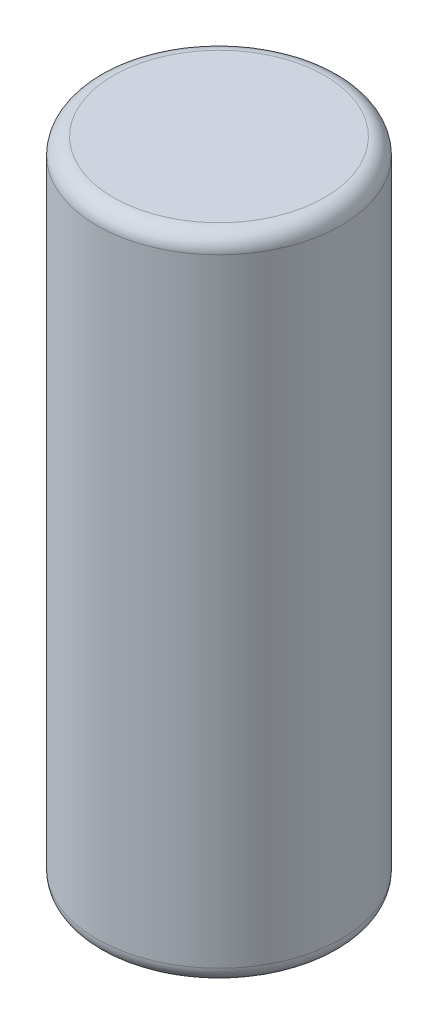
from build123d import *

# Parameters (mm, degrees)
SKETCH1_R           = 75
BOSS_EXTRUDE1_DEPTH = 200
FILLET1_R           = 10


with BuildPart() as part:
    # Sketch1 → Boss-Extrude1 (new, symmetric)
    with BuildSketch(Plane(origin=(0, 0, 0), x_dir=(1, 0, 0), z_dir=(0, 1, 0))):
        with Locations(Location((0, 0, 0), (0, 0, 90))):
            Circle(SKETCH1_R)
    extrude(amount=BOSS_EXTRUDE1_DEPTH, both=True)

    # Fillet1
    fillet1_edges = [part.edges().sort_by_distance(p)[0] for p in [
        (0, -200, 75),
        (0, 200, 75),
    ]]
    fillet(fillet1_edges, radius=FILLET1_R)


solid = part.part
